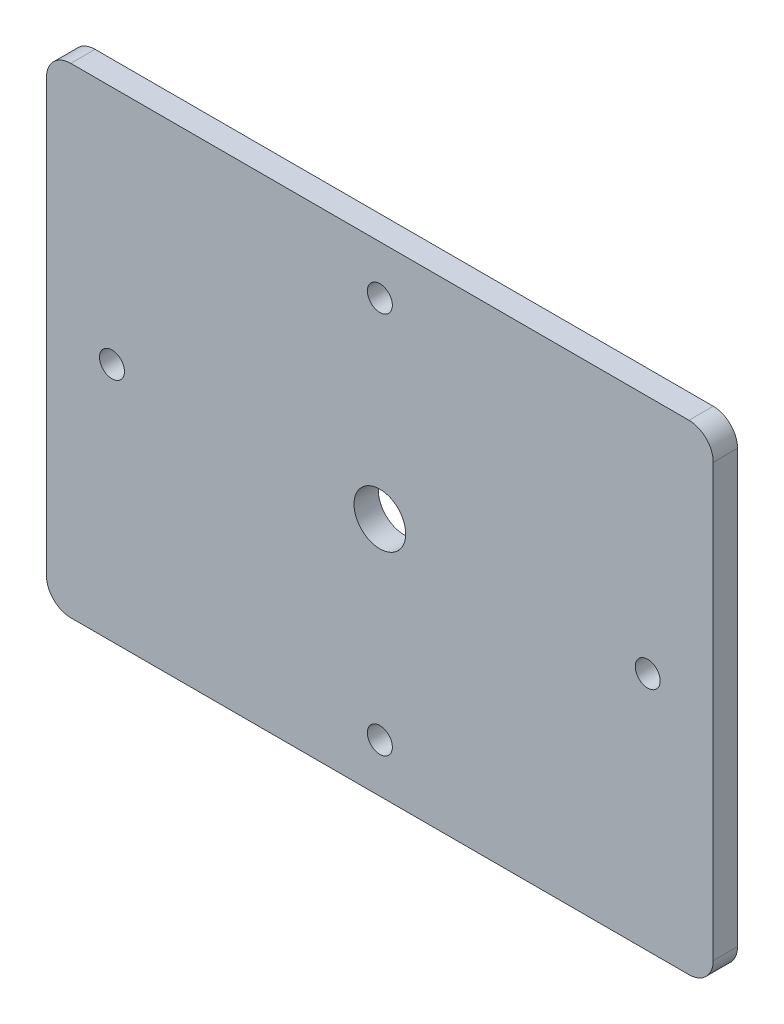
from build123d import *

# Parameters (mm, degrees)
SKETCH1_W               = 87.122
SKETCH1_H               = 62.738
BOSS_EXTRUDE1_DEPTH     = 3.175
F_4_CLEARANCE_HOLE1_D   = 3.2639
F_1_4_CLEARANCE_HOLE1_D = 6.7564
FILLET1_R               = 3.175


with BuildPart() as part:
    # Sketch1 → Boss-Extrude1 (new body)
    with BuildSketch(Plane.XY):
        with Locations((43.561, 31.369)):
            Rectangle(SKETCH1_W, SKETCH1_H)
    extrude(amount=BOSS_EXTRUDE1_DEPTH)

    # #4 Clearance Hole1 (through all)
    with Locations(Plane.XY.offset(3.175)):
        with Locations((43.561, 6.369), (78.561, 31.369), (8.561, 31.369), (43.561, 56.369)):
            Hole(F_4_CLEARANCE_HOLE1_D / 2)

    # 1/4 Clearance Hole1 (through all)
    with Locations(Plane.XY.offset(3.175)):
        with Locations((43.561, 31.369)):
            Hole(F_1_4_CLEARANCE_HOLE1_D / 2)

    # Fillet1
    fillet1_edges = [part.edges().sort_by_distance(p)[0] for p in [
        (0, 62.738, 1.5875),
        (87.122, 62.738, 1.5875),
        (87.122, 0, 1.5875),
        (0, 0, 1.5875),
    ]]
    fillet(fillet1_edges, radius=FILLET1_R)


solid = part.part
